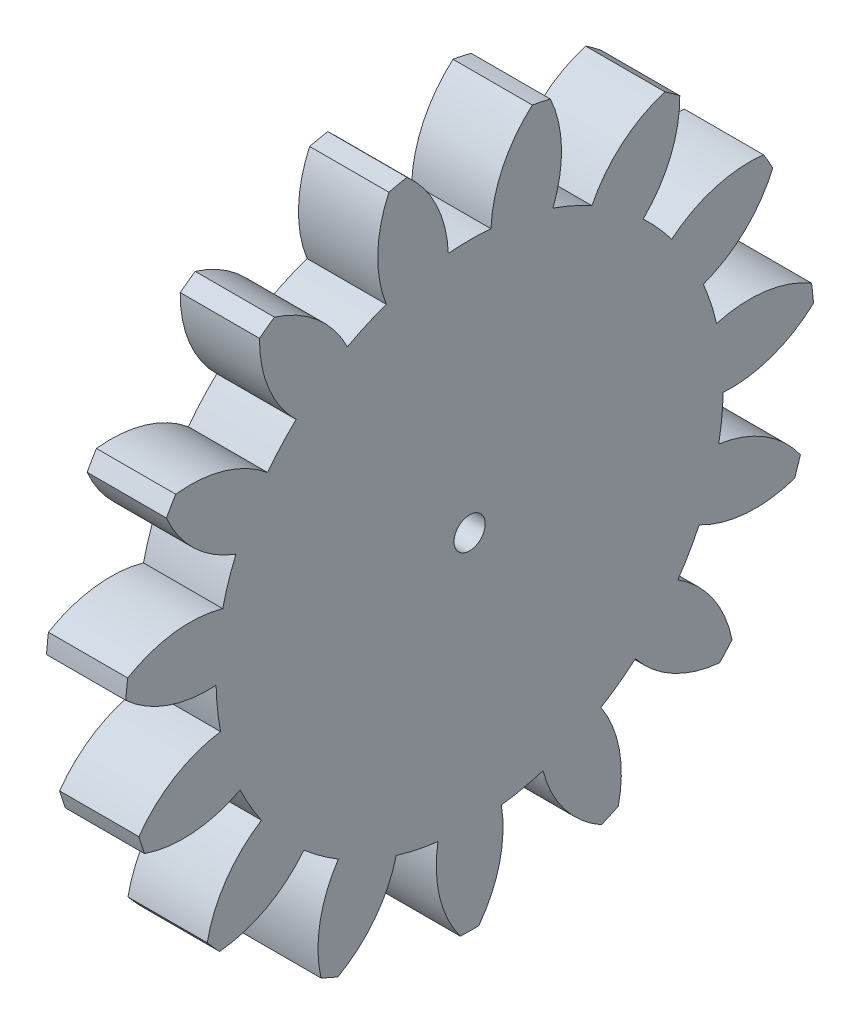
from build123d import *

# Parameters (mm, degrees)
BASPROSKE_W     = 12.7
BASPROSKE_H     = 55.25
TOOTHCUT_DEPTH  = 80.160691003
TEETHCUTS_COUNT = 15
TEETHCUTS_ANGLE = 336
BORSKE_R        = 2.5
BORE_DEPTH      = 50.0000508


with BuildPart() as part:
    # BasProSke → Base-Revolve (revolve)
    with BuildSketch(Plane(origin=(0, 0, 0), x_dir=(1, 0, 0), z_dir=(0, 1, 0)), mode=Mode.PRIVATE) as base_revolve_sk:
        with Locations((6.35, 27.625)):
            Rectangle(BASPROSKE_W, BASPROSKE_H)
    revolve(base_revolve_sk.sketch.rotate(Axis((-10, 0, 0), (1, 0, 0)), 180), axis=Axis((-10, 0, 0), (1, 0, 0)))

    # TooCutSke → ToothCut (cut, through all)
    with BuildSketch(Plane(origin=(0, 0, 0), x_dir=(0, 0, -1), z_dir=(1, 0, 0))):
        with BuildLine():
            ThreePointArc((3.414601006, 40.480240562), (0, 40.624), (-3.414601006, 40.480240562))
            ThreePointArc((-3.414601006, 40.480240562), (-5.310758866, 48.09911095), (-10.058002941, 54.352611915))
            ThreePointArc((-10.058002941, 54.352611915), (0, 55.2754), (10.058002941, 54.352611915))
            ThreePointArc((10.058002941, 54.352611915), (5.310758866, 48.09911095), (3.414601006, 40.480240562))
        make_face()
    toothcut = extrude(amount=TOOTHCUT_DEPTH, mode=Mode.SUBTRACT)

    # TeethCuts: ToothCut ×15 about axis
    teethcuts_axis = Axis((-10, 0, 0), (1, 0, 0))
    for i in range(1, TEETHCUTS_COUNT):
        add(toothcut.rotate(teethcuts_axis, i * TEETHCUTS_ANGLE / (TEETHCUTS_COUNT - 1)), mode=Mode.SUBTRACT)

    # BorSke → Bore (cut, symmetric)
    with BuildSketch(Plane(origin=(0, 0, 0), x_dir=(0, 0, -1), z_dir=(1, 0, 0))):
        with Locations(Location((0, 0, 0), (0, 0, 180))):
            Circle(BORSKE_R)
    extrude(amount=BORE_DEPTH, both=True, mode=Mode.SUBTRACT)


solid = part.part
